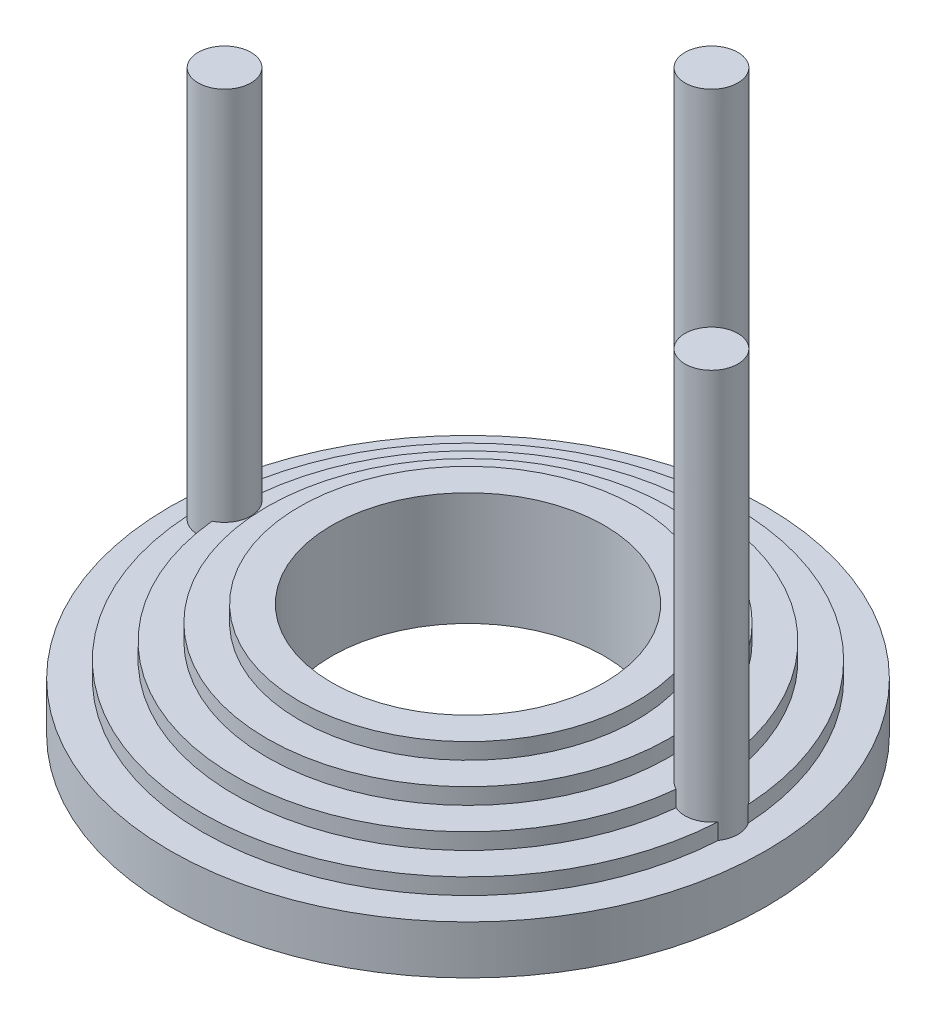
from build123d import *

# Parameters (mm, degrees)
SKETCH8_R      = 6.35
EXTRUDE1_DEPTH = 97.79


with BuildPart() as part:
    # Sketch1 → Revolve1 (revolve)
    with BuildSketch(Plane.XY):
        Polygon((-48.22399997, 35.097050796), (-40.462, 35.097050796), (-40.462, 38.978050908), (-32.7, 38.978050908), (-32.7, 35.097050796), (-32.7, 11.811050572), (-71.50999988, 11.811050572), (-71.50999988, 23.454050572), (-63.74799991, 23.454050572), (-63.74799991, 27.335050572), (-55.98599994, 27.335050572), (-55.98599994, 31.216050684), (-48.22399997, 31.216050684), align=None)
    revolve(axis=Axis((0, 0, 0), (0, 1, 0)))

    # Sketch8 → Extrude1 (add)
    with BuildSketch(Plane(origin=(0, 23.454050572, 0), x_dir=(1, 0, 0), z_dir=(0, 1, 0))):
        with Locations((-58.42, 0)):
            Circle(SKETCH8_R)
        with Locations((58.42, 0)):
            Circle(SKETCH8_R)
        with Locations((0, 58.42)):
            Circle(SKETCH8_R)
    extrude(amount=EXTRUDE1_DEPTH)


solid = part.part
